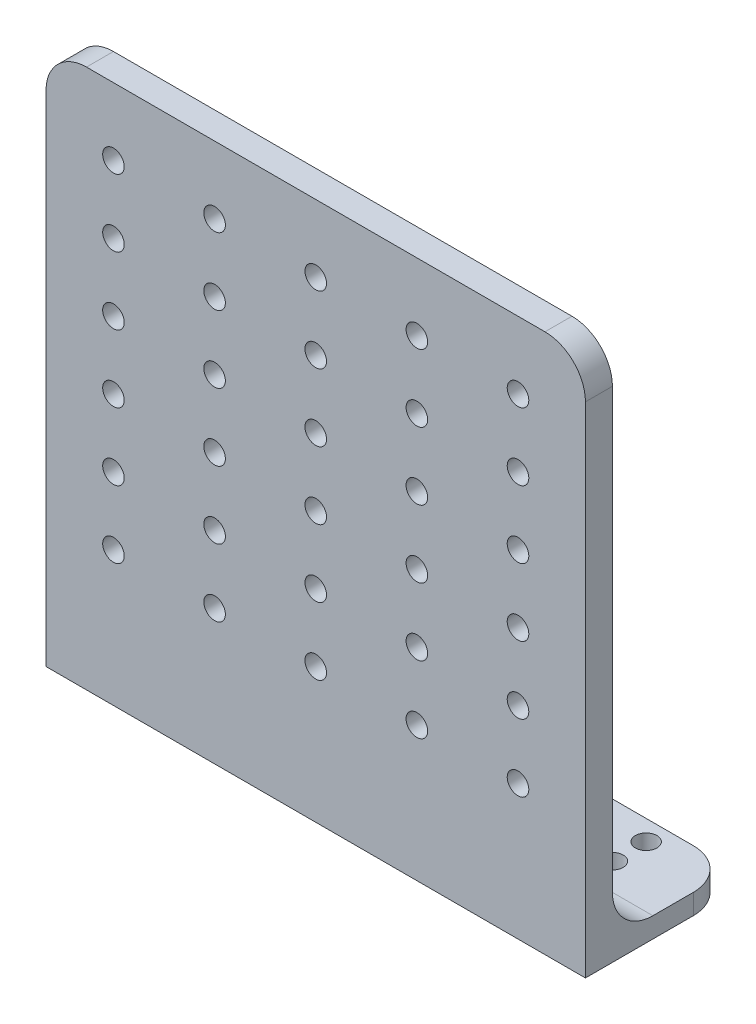
from build123d import *

# Parameters (mm, degrees)
SKETCH1_W           = 80
SKETCH1_H           = 80
BOSS_EXTRUDE1_DEPTH = 4
SKETCH2_R           = 1.6
CUT_EXTRUDE1_DEPTH  = 114.207773585
LPATTERN1_COUNT     = 6
LPATTERN1_PITCH     = 10
SKETCH3_W           = 80
SKETCH3_H           = 3
BOSS_EXTRUDE2_DEPTH = 18
SKETCH4_R           = 1.6
CUT_EXTRUDE2_DEPTH  = 113.485554628
LPATTERN2_COUNT     = 2
LPATTERN2_PITCH     = 5
FILLET1_R           = 6
FILLET2_R           = 6


with BuildPart() as part:
    # Sketch1 → Boss-Extrude1 (new body)
    with BuildSketch(Plane.XY):
        with Locations((40, 40)):
            Rectangle(SKETCH1_W, SKETCH1_H)
    extrude(amount=BOSS_EXTRUDE1_DEPTH)

    # Sketch2 → Cut-Extrude1 (cut, through all)
    with BuildSketch(Plane.XY.offset(4)):
        with Locations((10, 70)):
            Circle(SKETCH2_R)
        with Locations((25, 70)):
            Circle(SKETCH2_R)
        with Locations((40, 70)):
            Circle(SKETCH2_R)
        with Locations((55, 70)):
            Circle(SKETCH2_R)
        with Locations((70, 70)):
            Circle(SKETCH2_R)
    cut_extrude1 = extrude(amount=-CUT_EXTRUDE1_DEPTH, mode=Mode.SUBTRACT)

    # LPattern1: Cut-Extrude1 ×6
    with Locations(*[(0, -i * LPATTERN1_PITCH, 0) for i in range(1, LPATTERN1_COUNT)]):
        add(cut_extrude1, mode=Mode.SUBTRACT)

    # Sketch3 → Boss-Extrude2 (add)
    with BuildSketch(Plane(origin=(0, 0, 0), x_dir=(-1, 0, 0), z_dir=(0, 0, -1))):
        with Locations((-40, 1.5)):
            Rectangle(SKETCH3_W, SKETCH3_H)
    extrude(amount=BOSS_EXTRUDE2_DEPTH)

    # Sketch4 → Cut-Extrude2 (cut, through all)
    with BuildSketch(Plane(origin=(0, 3, 0), x_dir=(1, 0, 0), z_dir=(0, 1, 0))):
        with Locations(Location((70, 15, 0), (0, 0, 270))):
            Circle(SKETCH4_R)
        with Locations(Location((55, 15, 0), (0, 0, 270))):
            Circle(SKETCH4_R)
        with Locations(Location((40, 15, 0), (0, 0, 270))):
            Circle(SKETCH4_R)
        with Locations(Location((25, 15, 0), (0, 0, 270))):
            Circle(SKETCH4_R)
        with Locations(Location((10, 15, 0), (0, 0, 270))):
            Circle(SKETCH4_R)
    cut_extrude2 = extrude(amount=-CUT_EXTRUDE2_DEPTH, mode=Mode.SUBTRACT)

    # LPattern2: Cut-Extrude2 ×2
    with Locations(*[(0, 0, i * LPATTERN2_PITCH) for i in range(1, LPATTERN2_COUNT)]):
        add(cut_extrude2, mode=Mode.SUBTRACT)

    # Fillet1
    fillet1_edges = [part.edges().sort_by_distance(p)[0] for p in [
        (40, 3, 0),
    ]]
    fillet(fillet1_edges, radius=FILLET1_R)

    # Fillet2
    fillet2_edges = [part.edges().sort_by_distance(p)[0] for p in [
        (80, 1.5, -18),
        (0, 1.5, -18),
        (0, 80, 2),
        (80, 80, 2),
    ]]
    fillet(fillet2_edges, radius=FILLET2_R)


solid = part.part
